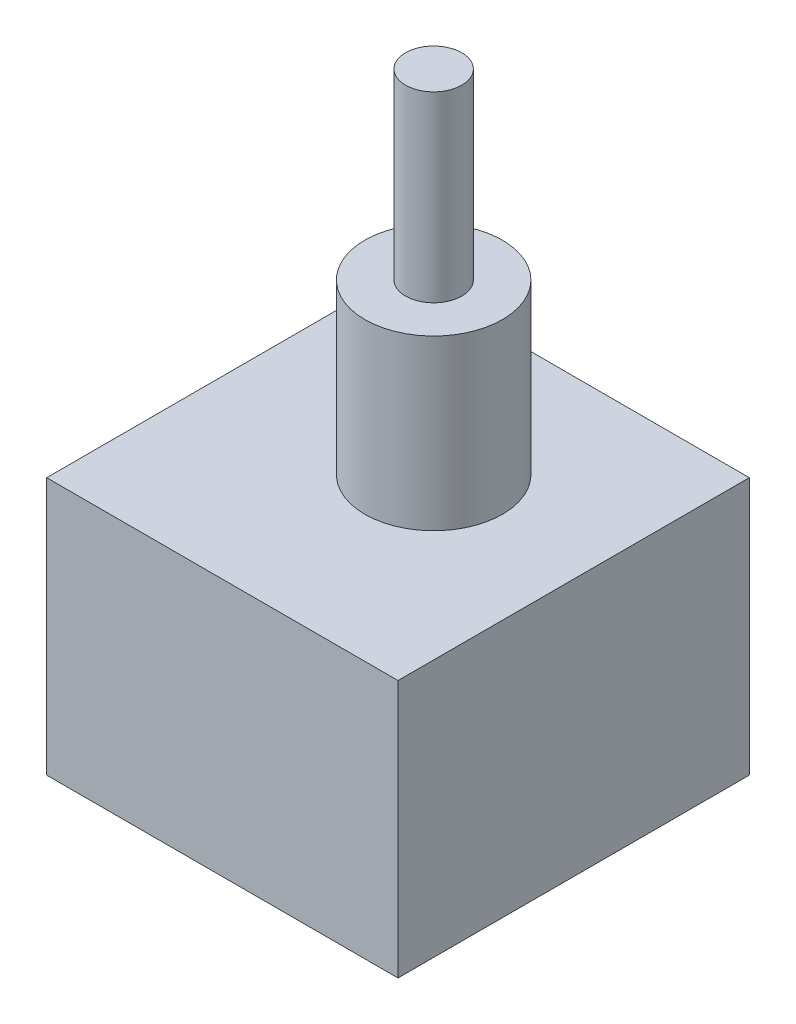
from build123d import *

# Parameters (mm, degrees)
SKETCH_1_W          = 30
SKETCH_1_H          = 30
EXTRUDE_275_DEPTH   = 22
SKETCH_2_R          = 5.875
EXTRUDE_2_DEPTH     = 14.4
SKETCH_4_R          = 2.4
EXTRUDE_3_DEPTH     = 15.6
SKETCH_5_R          = 2.5
CUT_EXTRUDE_1_DEPTH = 15


with BuildPart() as part:
    # Эскиз1 → Extrude 275 (new body)
    with BuildSketch(Plane(origin=(0, 0, 0), x_dir=(1, 0, 0), z_dir=(0, 1, 0))):
        with Locations((-1.294416244, -1.751269036)):
            Rectangle(SKETCH_1_W, SKETCH_1_H)
    extrude(amount=EXTRUDE_275_DEPTH)

    # Эскиз2 → Бобышка-Вытянуть2 (add)
    with BuildSketch(Plane(origin=(0, 22, 0), x_dir=(1, 0, 0), z_dir=(0, 1, 0))):
        with Locations(Location((0, 0, 0), (0, 0, 270))):
            Circle(SKETCH_2_R)
    extrude(amount=EXTRUDE_2_DEPTH)

    # Эскиз4 → Бобышка-Вытянуть3 (add)
    with BuildSketch(Plane(origin=(0, 36.4, 0), x_dir=(1, 0, 0), z_dir=(0, 1, 0))):
        with Locations(Location((0, 0, 0), (0, 0, 270))):
            Circle(SKETCH_4_R)
    extrude(amount=EXTRUDE_3_DEPTH)

    # Эскиз5 → Вырез-Вытянуть1 (cut)
    with BuildSketch(Plane.XZ):
        with Locations(Location((7, 0, 0), (0, 0, 270))):
            Circle(SKETCH_5_R)
        with Locations(Location((-7, 0, 0), (0, 0, 90))):
            Circle(SKETCH_5_R)
    extrude(amount=-CUT_EXTRUDE_1_DEPTH, mode=Mode.SUBTRACT)


solid = part.part
